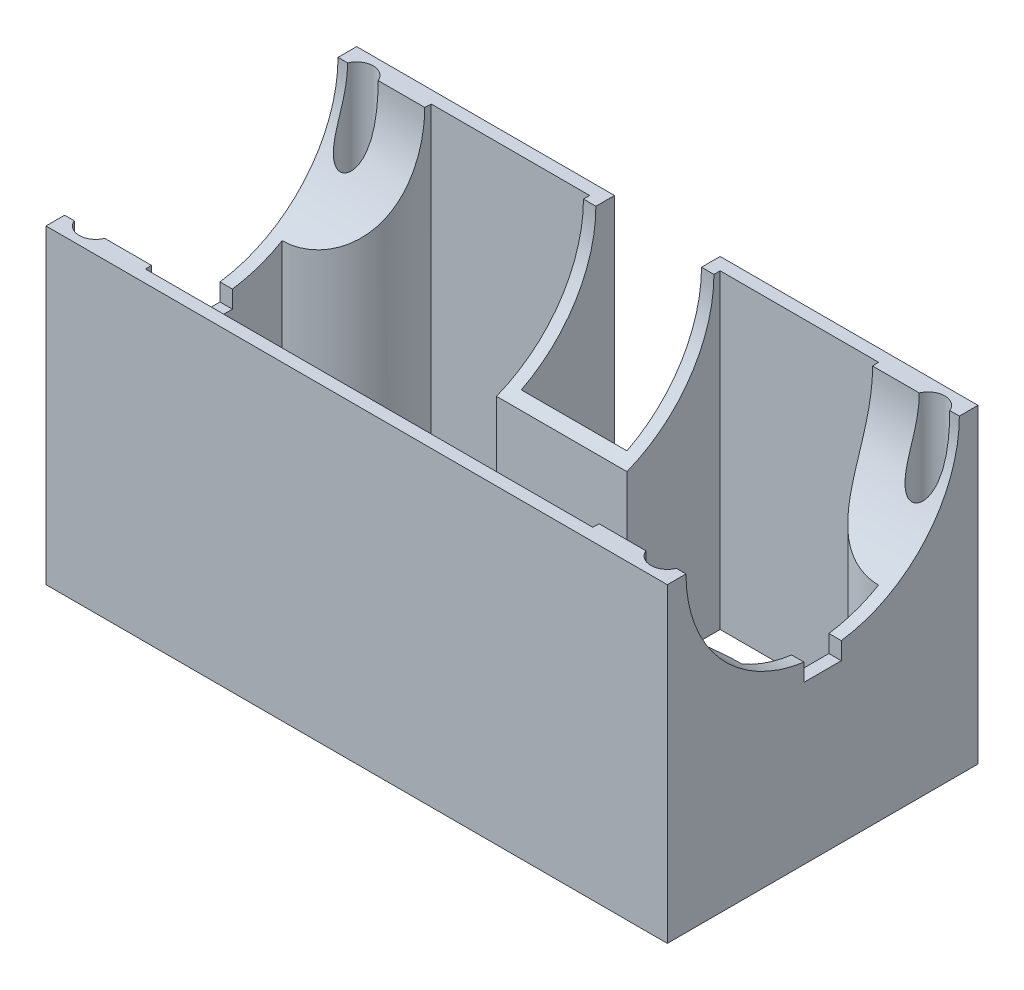
from build123d import *

# Parameters (mm, degrees)
SKETCH1_R           = 1.325
BOSS_EXTRUDE1_DEPTH = 25
SKETCH3_R           = 11
CUT_EXTRUDE1_DEPTH  = 58.957500418
SKETCH4_W           = 3
SKETCH4_H           = 1.5
CUT_EXTRUDE2_DEPTH  = 58.957500548


with BuildPart() as part:
    # Sketch1 → Boss-Extrude1 (new body)
    with BuildSketch(Plane(origin=(0, 0, 0), x_dir=(1, 0, 0), z_dir=(0, 1, 0))):
        Polygon((-25, -9.700592993), (25, -9.700592993), (25, 15.299407007), (4.25, 15.299407007), (4.25, 7.799407007), (-4.25, 7.799407007), (-4.25, 15.299407007), (-25, 15.299407007), align=None)
        with Locations(Location((-23, 13.299407007, 0), (0, 0, 270))):
            Circle(SKETCH1_R, mode=Mode.SUBTRACT)
        with Locations(Location((23, 13.299407007, 0), (0, 0, 270))):
            Circle(SKETCH1_R, mode=Mode.SUBTRACT)
        with Locations(Location((23, -7.700592993, 0), (0, 0, 270))):
            Circle(SKETCH1_R, mode=Mode.SUBTRACT)
        with Locations(Location((-23, -7.700592993, 0), (0, 0, 270))):
            Circle(SKETCH1_R, mode=Mode.SUBTRACT)
        with BuildLine():
            Line((-5.25, 14.299407007), (-5.25, 6.799407007))
            Line((-5.25, 6.799407007), (5.25, 6.799407007))
            Line((5.25, 6.799407007), (5.25, 14.299407007))
            Line((5.25, 14.299407007), (18, 14.299407007))
            ThreePointArc((18, 14.299407007), (19.757359313, 10.05676632), (24, 8.299407007))
            Line((24, 8.299407007), (24, -2.700592993))
            ThreePointArc((24, -2.700592993), (19.757359313, -4.457952306), (18, -8.700592993))
            Line((18, -8.700592993), (-18, -8.700592993))
            ThreePointArc((-18, -8.700592993), (-19.757359313, -4.457952306), (-24, -2.700592993))
            Line((-24, -2.700592993), (-24, 8.299407007))
            ThreePointArc((-24, 8.299407007), (-19.757359313, 10.05676632), (-18, 14.299407007))
            Line((-18, 14.299407007), (-5.25, 14.299407007))
        make_face(mode=Mode.SUBTRACT)
    extrude(amount=BOSS_EXTRUDE1_DEPTH)

    # Sketch3 → Cut-Extrude1 (cut, through all)
    with BuildSketch(Plane(origin=(25, 0, 0), x_dir=(0, 0, -1), z_dir=(1, 0, 0))):
        with Locations((2.799407007, 25)):
            Circle(SKETCH3_R)
    extrude(amount=-CUT_EXTRUDE1_DEPTH, mode=Mode.SUBTRACT)

    # Sketch4 → Cut-Extrude2 (cut, through all)
    with BuildSketch(Plane(origin=(25, 0, 0), x_dir=(0, 0, -1), z_dir=(1, 0, 0))):
        with Locations((2.799407007, 13.45)):
            Rectangle(SKETCH4_W, SKETCH4_H)
    extrude(amount=-CUT_EXTRUDE2_DEPTH, mode=Mode.SUBTRACT)


solid = part.part
